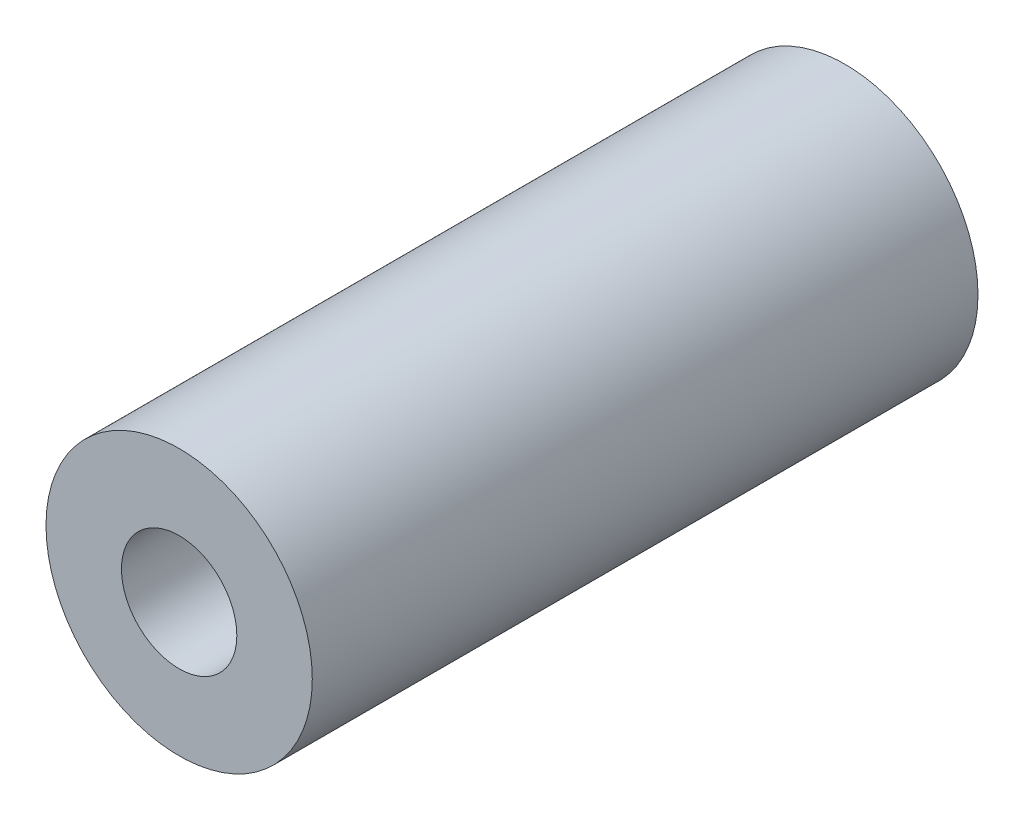
from build123d import *

# Parameters (mm, degrees)
SKETCH_1_R      = 3
SKETCH_1_R_2    = 1.3
EXTRUDE_1_DEPTH = 15


with BuildPart() as part:
    # ｽｹｯﾁ1 → ﾎﾞｽ - 押し出し1 (new body)
    with BuildSketch(Plane.XY):
        Circle(SKETCH_1_R)
        Circle(SKETCH_1_R_2, mode=Mode.SUBTRACT)
    extrude(amount=EXTRUDE_1_DEPTH)


solid = part.part
